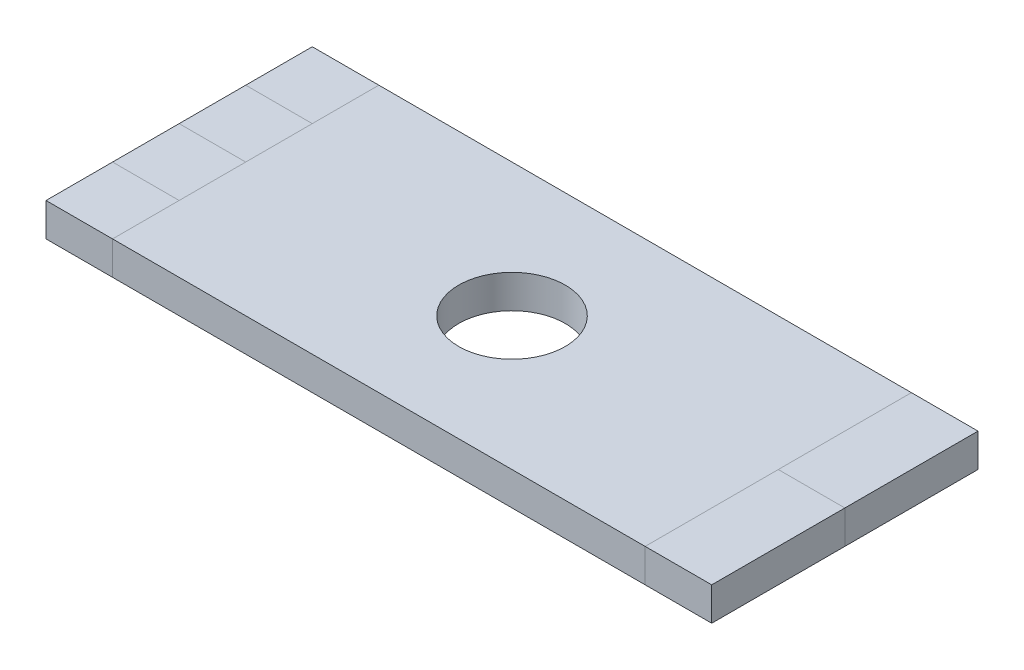
from build123d import *

# Parameters (mm, degrees)
SKETCH1_W           = 50.8
SKETCH1_H           = 25.4
SKETCH1_R           = 5.08
BOSS_EXTRUDE1_DEPTH = 3.175
SKETCH2_W           = 6.35
SKETCH2_H           = 3.175
BOSS_EXTRUDE3_DEPTH = 6.35
SKETCH2_4_W         = 6.35
SKETCH2_4_H         = 3.175
BOSS_EXTRUDE4_DEPTH = 6.35
SKETCH2_6_W         = 6.35
SKETCH2_6_H         = 3.175
BOSS_EXTRUDE6_DEPTH = 6.35
SKETCH2_7_W         = 6.35
SKETCH2_7_H         = 3.175
BOSS_EXTRUDE7_DEPTH = 6.35
SKETCH4_W           = 12.7
SKETCH4_H           = 3.175
BOSS_EXTRUDE8_DEPTH = 6.35
SKETCH4_3_W         = 12.7
SKETCH4_3_H         = 3.175
BOSS_EXTRUDE9_DEPTH = 6.35


with BuildPart() as part:
    # Sketch1 → Boss-Extrude1 (new body)
    with BuildSketch(Plane(origin=(0, 0, 0), x_dir=(1, 0, 0), z_dir=(0, 1, 0))):
        Rectangle(SKETCH1_W, SKETCH1_H)
        Circle(SKETCH1_R, mode=Mode.SUBTRACT)
    extrude(amount=BOSS_EXTRUDE1_DEPTH)


with BuildPart() as body_2:
    # Sketch2 → Boss-Extrude3 (new body)
    with BuildSketch(Plane.ZY.offset(25.4)):
        with Locations((-9.525, 1.5875)):
            Rectangle(SKETCH2_W, SKETCH2_H)
    extrude(amount=BOSS_EXTRUDE3_DEPTH)


with BuildPart() as body_3:
    # Sketch2<4> → Boss-Extrude4 (new body)
    with BuildSketch(Plane.ZY.offset(25.4)):
        with Locations((-3.175, 1.5875)):
            Rectangle(SKETCH2_4_W, SKETCH2_4_H)
    extrude(amount=BOSS_EXTRUDE4_DEPTH)


with BuildPart() as body_4:
    # Sketch2<6> → Boss-Extrude6 (new body)
    with BuildSketch(Plane.ZY.offset(25.4)):
        with Locations((3.175, 1.5875)):
            Rectangle(SKETCH2_6_W, SKETCH2_6_H)
    extrude(amount=BOSS_EXTRUDE6_DEPTH)


with BuildPart() as body_5:
    # Sketch2<7> → Boss-Extrude7 (new body)
    with BuildSketch(Plane.ZY.offset(25.4)):
        with Locations((9.525, 1.5875)):
            Rectangle(SKETCH2_7_W, SKETCH2_7_H)
    extrude(amount=BOSS_EXTRUDE7_DEPTH)


with BuildPart() as body_6:
    # Sketch4 → Boss-Extrude8 (new body)
    with BuildSketch(Plane(origin=(25.4, 0, 0), x_dir=(0, 0, -1), z_dir=(1, 0, 0))):
        with Locations((-6.35, 1.5875)):
            Rectangle(SKETCH4_W, SKETCH4_H)
    extrude(amount=BOSS_EXTRUDE8_DEPTH)


with BuildPart() as body_7:
    # Sketch4<3> → Boss-Extrude9 (new body)
    with BuildSketch(Plane(origin=(25.4, 0, 0), x_dir=(0, 0, -1), z_dir=(1, 0, 0))):
        with Locations((6.35, 1.5875)):
            Rectangle(SKETCH4_3_W, SKETCH4_3_H)
    extrude(amount=BOSS_EXTRUDE9_DEPTH)


solid = Compound([part.part, body_2.part, body_3.part, body_4.part, body_5.part, body_6.part, body_7.part])
